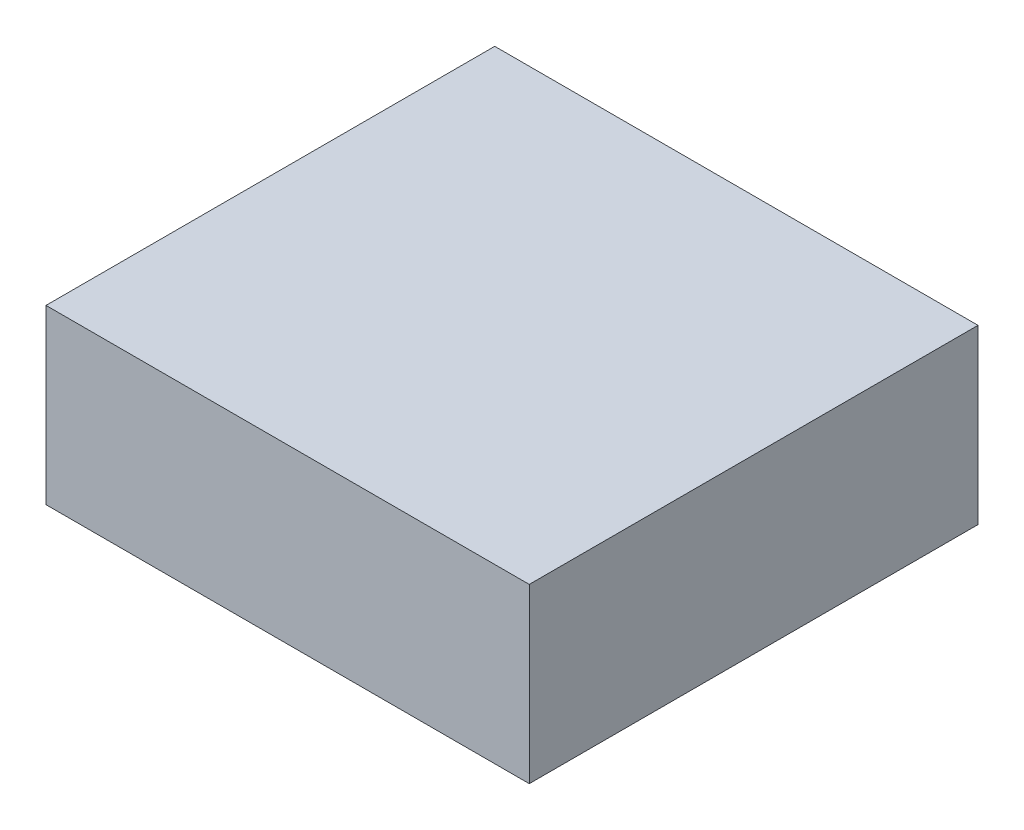
from build123d import *

# Parameters (mm, degrees)
SKETCH1_W           = 70
SKETCH1_H           = 65
BOSS_EXTRUDE1_DEPTH = 25


with BuildPart() as part:
    # Sketch1 → Boss-Extrude1 (new body)
    with BuildSketch(Plane(origin=(0, 0, 0), x_dir=(1, 0, 0), z_dir=(0, 1, 0))):
        Rectangle(SKETCH1_W, SKETCH1_H)
    extrude(amount=BOSS_EXTRUDE1_DEPTH)


solid = part.part
